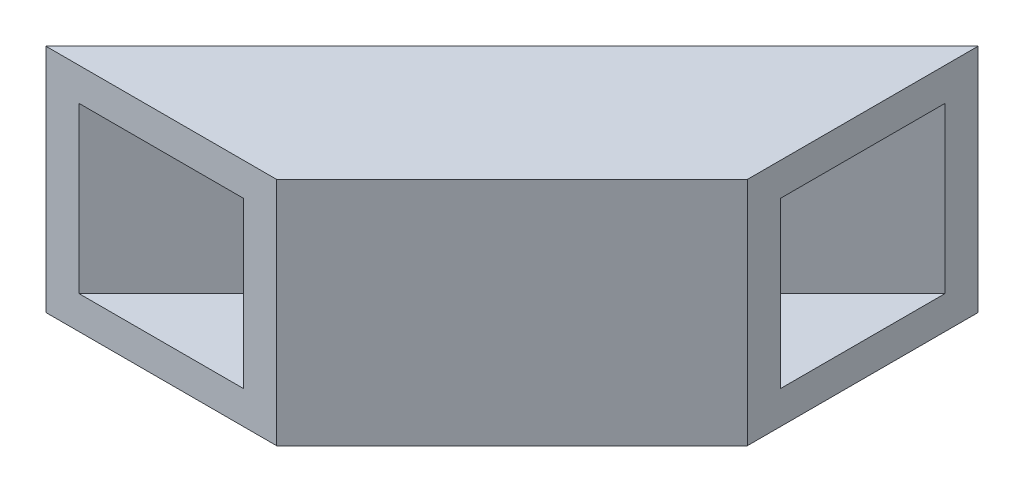
from build123d import *

# Parameters (mm, degrees)
CROQUIS1_W              = 21
CROQUIS1_H              = 21
CROQUIS1_W_2            = 15
CROQUIS1_H_2            = 15
SALIENTE_EXTRUIR1_DEPTH = 70
CROQUIS6_W              = 21
CROQUIS6_H              = 21
CROQUIS6_W_2            = 15
CROQUIS6_H_2            = 15
SALIENTE_EXTRUIR2_DEPTH = 60
CORTAR_EXTRUIR2_DEPTH   = 91.234165061
CROQUIS8_W              = 21
CROQUIS8_H              = 21
CROQUIS8_W_2            = 15
CROQUIS8_H_2            = 15
SALIENTE_EXTRUIR3_DEPTH = 60
CROQUIS9_W              = 21
CROQUIS9_H              = 70
CROQUIS9_W_2            = 60
CROQUIS9_H_2            = 21
CORTAR_EXTRUIR3_DEPTH   = 118.437065189


with BuildPart() as part:
    # Croquis1 → Saliente-Extruir1 (new body)
    with BuildSketch(Plane.XY):
        Rectangle(CROQUIS1_W, CROQUIS1_H)
        Rectangle(CROQUIS1_W_2, CROQUIS1_H_2, mode=Mode.SUBTRACT)
    extrude(amount=SALIENTE_EXTRUIR1_DEPTH)

    # Croquis6 → Saliente-Extruir2 (add, along a direction that is not the sketch's normal)
    with BuildSketch(Plane(origin=(0, 0, 0), x_dir=(-1, 0, 0), z_dir=(0, 0, -1))):
        Rectangle(CROQUIS6_W, CROQUIS6_H)
        Rectangle(CROQUIS6_W_2, CROQUIS6_H_2, mode=Mode.SUBTRACT)
    extrude(amount=SALIENTE_EXTRUIR2_DEPTH, dir=(0.7071067811865512, 0, -0.7071067811865438))

    # Croquis7 → Cortar-Extruir2 (cut, through all)
    with BuildSketch(Plane(origin=(0, 10.5, 0), x_dir=(1, 0, 0), z_dir=(0, 1, 0))):
        Polygon((31.926406871, 42.426406871), (31.926406871, 21.426406871), (52.926406871, 42.426406871), align=None)
    extrude(amount=-CORTAR_EXTRUIR2_DEPTH, mode=Mode.SUBTRACT)

    # Croquis8 → Saliente-Extruir3 (add)
    with BuildSketch(Plane(origin=(31.926406871, 0, 0), x_dir=(0, 0, -1), z_dir=(1, 0, 0))):
        with Locations((31.926406871, 0)):
            Rectangle(CROQUIS8_W, CROQUIS8_H)
        with Locations((31.926406871, 0)):
            Rectangle(CROQUIS8_W_2, CROQUIS8_H_2, mode=Mode.SUBTRACT)
    extrude(amount=SALIENTE_EXTRUIR3_DEPTH)

    # Croquis9 → Cortar-Extruir3 (cut, through all)
    with BuildSketch(Plane(origin=(0, 10.5, 0), x_dir=(1, 0, 0), z_dir=(0, 1, 0))):
        with Locations((0, -35)):
            Rectangle(CROQUIS9_W, CROQUIS9_H)
        with Locations((61.926406871, 31.926406871)):
            Rectangle(CROQUIS9_W_2, CROQUIS9_H_2)
    extrude(amount=-CORTAR_EXTRUIR3_DEPTH, mode=Mode.SUBTRACT)


solid = part.part
